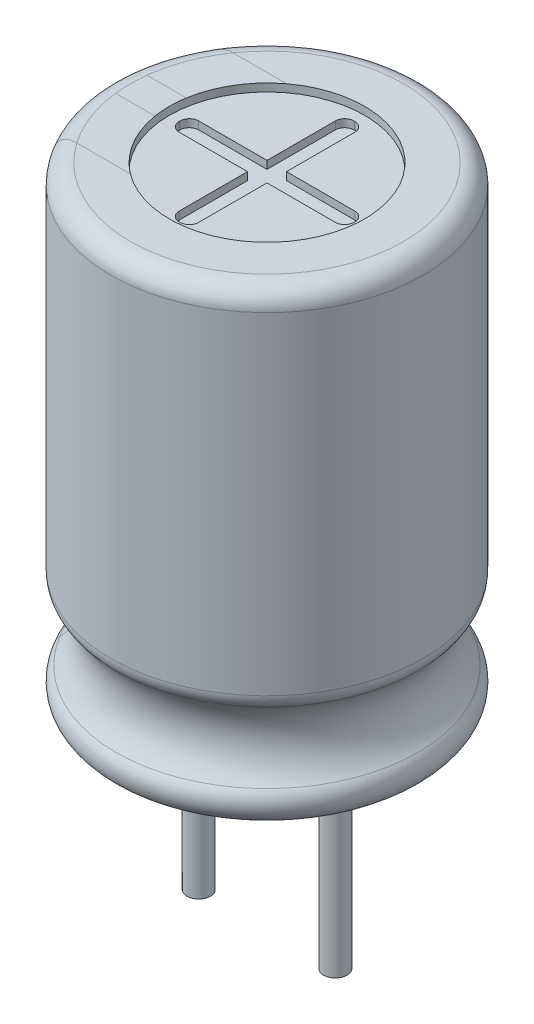
from build123d import *

# Parameters (mm, degrees)
SKETCH_3_R          = 2.5
CUT_EXTRUDE_1_DEPTH = 0.2
CUT_EXTRUDE_2_DEPTH = 0.2
CUT_EXTRUDE_START   = -0.2
SKETCH_5_R          = 2.5
CUT_EXTRUDE_3_DEPTH = 0.2
SKETCH_7_R          = 0.3
EXTRUDE_2_DEPTH     = 5.2


with BuildPart() as part:
    # Эскиз2 → Повернуть1 (revolve)
    with BuildSketch(Plane.XY):
        with BuildLine():
            Line((0, 0), (3.5, 0))
            ThreePointArc((3.5, 0), (3.853553391, 0.146446609), (4, 0.5))
            ThreePointArc((4, 0.5), (3.964238345, 0.685695338), (3.862068966, 0.844827586))
            ThreePointArc((3.862068966, 0.844827586), (3.5, 1.75), (3.862068966, 2.655172414))
            ThreePointArc((3.862068966, 2.655172414), (3.964238345, 2.814304662), (4, 3))
            Line((4, 3), (4, 11.5))
            ThreePointArc((4, 11.5), (3.853553391, 11.853553391), (3.5, 12))
            Line((3.5, 12), (0, 12))
            Line((0, 12), (0, 0))
        make_face()
    revolve(axis=Axis((0, 0, 0), (0, 1, 0)))

    # Эскиз3 → Вырез-Вытянуть1 (cut)
    with BuildSketch(Plane(origin=(0, 12, 0), x_dir=(1, 0, 0), z_dir=(0, 1, 0))):
        with Locations(Location((0, 0, 0), (0, 0, 180))):
            Circle(SKETCH_3_R)
    extrude(amount=-CUT_EXTRUDE_1_DEPTH, mode=Mode.SUBTRACT)

    # Эскиз4 → Вырез-Вытянуть2 (cut)
    with BuildSketch(Plane(origin=(0, 11.8, 0), x_dir=(1, 0, 0), z_dir=(0, 1, 0))):
        with BuildLine():
            Line((-0.25, -0.25), (-0.25, -2))
            ThreePointArc((-0.25, -2), (-0.179705627, -2.169705627), (-0.01, -2.24))
            Line((-0.01, -2.24), (0.01, -2.24))
            ThreePointArc((0.01, -2.24), (0.179705627, -2.169705627), (0.25, -2))
            Line((0.25, -2), (0.25, -0.25))
            Line((0.25, -0.25), (2, -0.25))
            ThreePointArc((2, -0.25), (2.169705627, -0.179705627), (2.24, -0.01))
            Line((2.24, -0.01), (2.24, 0.01))
            ThreePointArc((2.24, 0.01), (2.169705627, 0.179705627), (2, 0.25))
            Line((2, 0.25), (0.25, 0.25))
            Line((0.25, 0.25), (0.25, 2))
            ThreePointArc((0.25, 2), (0.179705627, 2.169705627), (0.01, 2.24))
            Line((0.01, 2.24), (-0.01, 2.24))
            ThreePointArc((-0.01, 2.24), (-0.179705627, 2.169705627), (-0.25, 2))
            Line((-0.25, 2), (-0.25, 0.25))
            Line((-0.25, 0.25), (-2, 0.25))
            ThreePointArc((-2, 0.25), (-2.169705627, 0.179705627), (-2.24, 0.01))
            Line((-2.24, 0.01), (-2.24, -0.01))
            ThreePointArc((-2.24, -0.01), (-2.169705627, -0.179705627), (-2, -0.25))
            Line((-2, -0.25), (-0.25, -0.25))
        make_face()
    extrude(amount=-CUT_EXTRUDE_2_DEPTH, mode=Mode.SUBTRACT)

    # Эскиз5 → Вырез-Вытянуть3 (cut)
    with BuildSketch(Plane.XZ.offset(CUT_EXTRUDE_START)):
        with Locations(Location((0, 0, 0), (0, 0, 180))):
            Circle(SKETCH_5_R)
    extrude(amount=CUT_EXTRUDE_3_DEPTH, mode=Mode.SUBTRACT)

    # Эскиз7 → Бобышка-Вытянуть2 (add)
    with BuildSketch(Plane.XZ.offset(-0.2)):
        with Locations((-1.75, 0)):
            Circle(SKETCH_7_R)
        with Locations((1.75, 0)):
            Circle(SKETCH_7_R)
    extrude(amount=EXTRUDE_2_DEPTH)


solid = part.part
